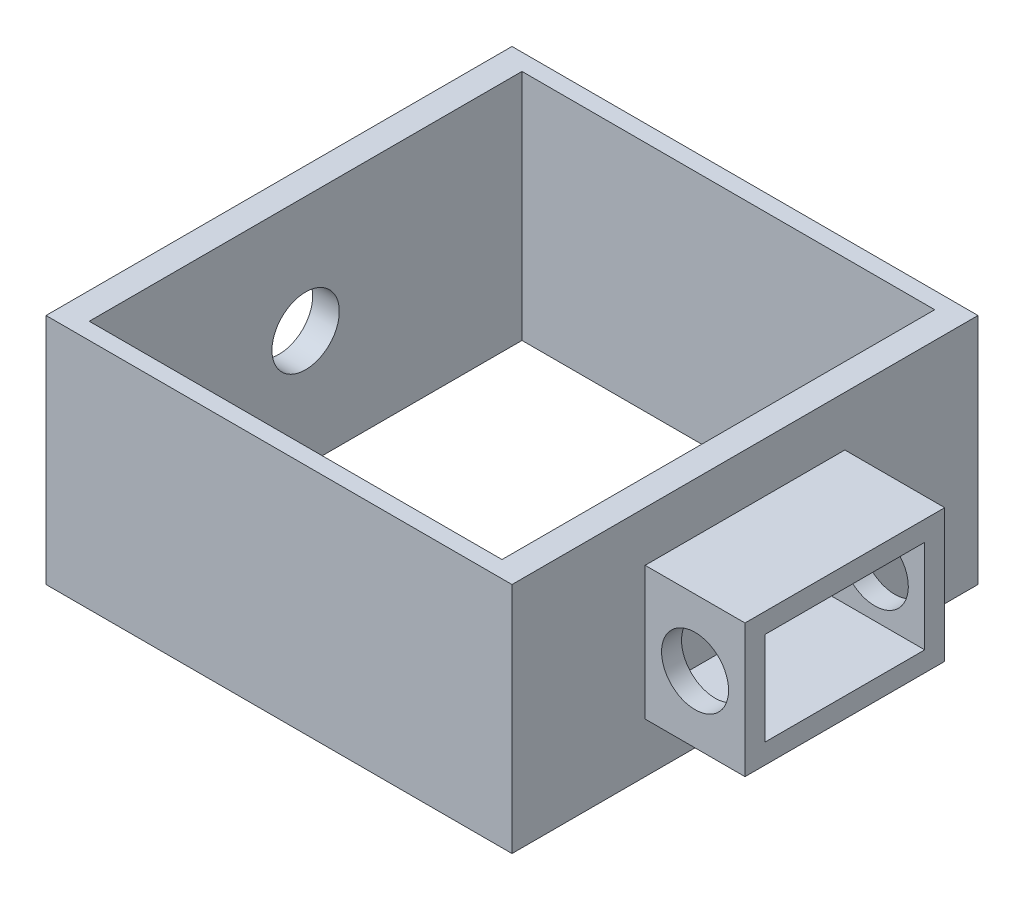
from build123d import *

# Parameters (mm, degrees)
SKETCH1_W           = 70
SKETCH1_H           = 70
BOSS_EXTRUDE1_DEPTH = 35
SKETCH2_W           = 62
SKETCH2_H           = 65
CUT_EXTRUDE1_DEPTH  = 61.621778265
SKETCH3_R           = 5.056768915
CUT_EXTRUDE2_DEPTH  = 15
SKETCH4_W           = 30
SKETCH4_H           = 20
BOSS_EXTRUDE2_DEPTH = 15
SKETCH6_W           = 24
SKETCH6_H           = 14
CUT_EXTRUDE3_DEPTH  = 15
SKETCH7_R           = 5.033880115
CUT_EXTRUDE4_DEPTH  = 79.89866919


with BuildPart() as part:
    # Sketch1 → Boss-Extrude1 (new body)
    with BuildSketch(Plane(origin=(0, 0, 0), x_dir=(1, 0, 0), z_dir=(0, 1, 0))):
        Rectangle(SKETCH1_W, SKETCH1_H)
    extrude(amount=BOSS_EXTRUDE1_DEPTH)

    # Sketch2 → Cut-Extrude1 (cut, through all)
    with BuildSketch(Plane(origin=(0, 35, 0), x_dir=(1, 0, 0), z_dir=(0, 1, 0))):
        Rectangle(SKETCH2_W, SKETCH2_H)
    extrude(amount=-CUT_EXTRUDE1_DEPTH, mode=Mode.SUBTRACT)

    # Sketch3 → Cut-Extrude2 (cut)
    with BuildSketch(Plane.ZY.offset(35)):
        with Locations((0, 17.5)):
            Circle(SKETCH3_R)
    extrude(amount=-CUT_EXTRUDE2_DEPTH, mode=Mode.SUBTRACT)

    # Sketch4 → Boss-Extrude2 (add)
    with BuildSketch(Plane(origin=(35, 0, 0), x_dir=(0, 0, -1), z_dir=(1, 0, 0))):
        with Locations((0, 17.5)):
            Rectangle(SKETCH4_W, SKETCH4_H)
    extrude(amount=BOSS_EXTRUDE2_DEPTH)

    # Sketch6 → Cut-Extrude3 (cut)
    with BuildSketch(Plane(origin=(50, 0, 0), x_dir=(0, 0, -1), z_dir=(1, 0, 0))):
        with Locations((0, 17.5)):
            Rectangle(SKETCH6_W, SKETCH6_H)
    extrude(amount=-CUT_EXTRUDE3_DEPTH, mode=Mode.SUBTRACT)

    # Sketch7 → Cut-Extrude4 (cut, through all)
    with BuildSketch(Plane.XY.offset(15)):
        with Locations((42.5, 17.5)):
            Circle(SKETCH7_R)
    extrude(amount=-CUT_EXTRUDE4_DEPTH, mode=Mode.SUBTRACT)


solid = part.part
